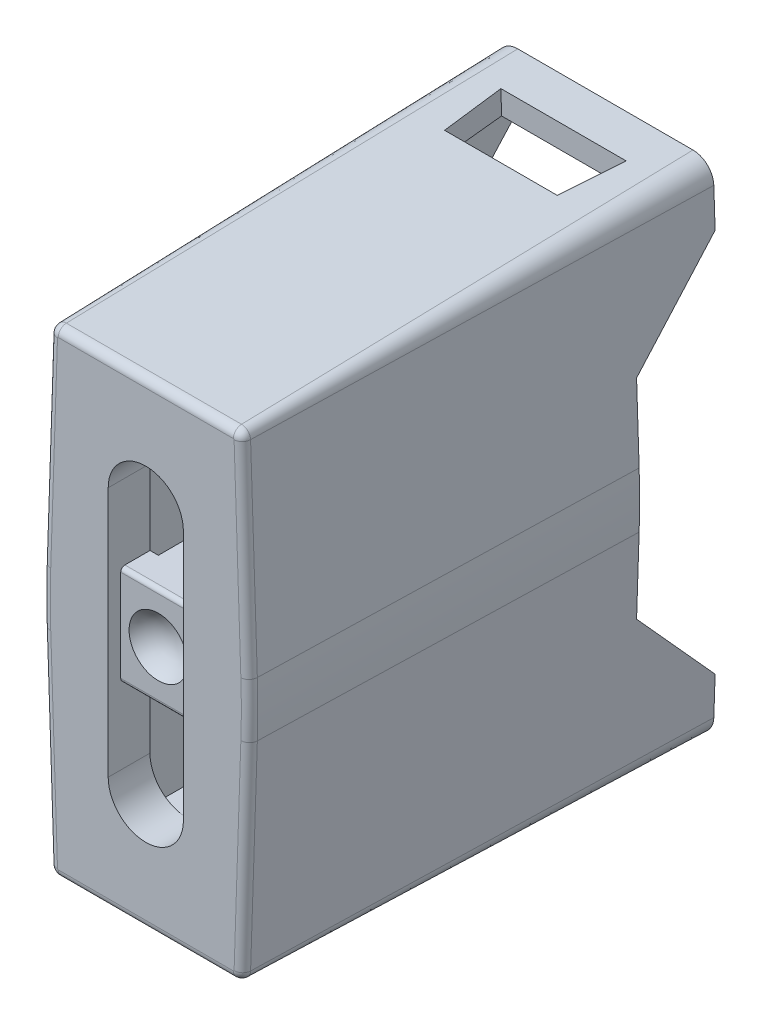
from build123d import *

# Parameters (mm, degrees)
BOSS_EXTRUDE1_DEPTH = 13.97
BOSS_EXTRUDE1_TAPER = 1.5
SKETCH2_W           = 5.461
SKETCH2_H           = 13.716
CUT_EXTRUDE1_DEPTH  = 8.255
CUT_EXTRUDE2_DEPTH  = 18.403644698
SKETCH5_W           = 5.334
SKETCH5_H           = 3.048
BOSS_EXTRUDE2_DEPTH = 2.286
SKETCH7_W           = 1.778
SKETCH7_H           = 3.048
CUT_EXTRUDE5_DEPTH  = 4.445
SKETCH9_W           = 1.778
SKETCH9_H           = 2.54
SKETCH9_H_2         = 1.397
CUT_EXTRUDE6_DEPTH  = 1.524
FILLET2_RADIUS      = 0.889
FILLET2_LENGTH      = 1.397
FILLET3_RADIUS      = 0.889
FILLET3_LENGTH      = 2.54
FILLET4_RADIUS      = 0.889
FILLET4_LENGTH      = 1.397
FILLET5_R           = 0.254
FILLET6_R           = 0.127
CUT_EXTRUDE7_REACH  = 23.72
CUT_EXTRUDE8_REACH  = 23.712
CUT_EXTRUDE10_DEPTH = 18.403644779


with BuildPart() as part:
    # Sketch1 → Boss-Extrude1 (new body)
    with BuildSketch(Plane.XY):
        with BuildLine():
            ThreePointArc((6.827680219, 7.006153229), (6.634503314, 7.441430334), (6.193032647, 7.62))
            Line((6.193032647, 7.62), (0.868167353, 7.62))
            ThreePointArc((0.868167353, 7.62), (0.426696686, 7.441430334), (0.233519781, 7.006153229))
            Line((0.233519781, 7.006153229), (0.028202051, 0.84612915))
            ThreePointArc((0.028202051, 0.84612915), (0.017629462, 0.423123288), (0.01410494, 0))
            ThreePointArc((0.01410494, 0), (0.017629462, -0.423123288), (0.028202051, -0.84612915))
            Line((0.028202051, -0.84612915), (0.233519781, -7.006153229))
            ThreePointArc((0.233519781, -7.006153229), (0.426696686, -7.441430334), (0.868167353, -7.62))
            Line((0.868167353, -7.62), (6.193032647, -7.62))
            ThreePointArc((6.193032647, -7.62), (6.634503314, -7.441430334), (6.827680219, -7.006153229))
            Line((6.827680219, -7.006153229), (7.032997949, -0.84612915))
            ThreePointArc((7.032997949, -0.84612915), (7.043570538, -0.423123288), (7.04709506, 0))
            ThreePointArc((7.04709506, 0), (7.043570538, 0.423123288), (7.032997949, 0.84612915))
            Line((7.032997949, 0.84612915), (6.827680219, 7.006153229))
        make_face()
    extrude(amount=BOSS_EXTRUDE1_DEPTH, taper=BOSS_EXTRUDE1_TAPER)

    # Sketch2 → Cut-Extrude1 (cut)
    with BuildSketch(Plane(origin=(0, 0, 0), x_dir=(-1, 0, 0), z_dir=(0, 0, -1))):
        with Locations((-3.52354753, 0)):
            Rectangle(SKETCH2_W, SKETCH2_H)
    extrude(amount=-CUT_EXTRUDE1_DEPTH, mode=Mode.SUBTRACT)

    # Sketch3 → Cut-Extrude2 (cut, through all)
    with BuildSketch(Plane.XY.offset(13.97)):
        with BuildLine():
            Line((4.6736, 3.81), (4.6736, -3.81))
            ThreePointArc((4.6736, -3.81), (3.5306, -4.953), (2.3876, -3.81))
            Line((2.3876, -3.81), (2.3876, 3.81))
            ThreePointArc((2.3876, 3.81), (3.5306, 4.953), (4.6736, 3.81))
        make_face()
    extrude(amount=-CUT_EXTRUDE2_DEPTH, mode=Mode.SUBTRACT)

    # Sketch5 → Boss-Extrude2 (add)
    with BuildSketch(Plane.ZY.offset(-4.6736)):
        with Locations((10.922, 0)):
            Rectangle(SKETCH5_W, SKETCH5_H)
    extrude(amount=BOSS_EXTRUDE2_DEPTH)

    # Sketch6 → Cut-Revolve1 (revolve, cut)
    with BuildSketch(Plane(origin=(0, 0, 0), x_dir=(1, 0, 0), z_dir=(0, 1, 0)), mode=Mode.PRIVATE) as cut_revolve1_sk:
        with BuildLine():
            Line((3.5306, -13.589), (3.5306, -13.081))
            ThreePointArc((3.5306, -13.081), (3.018646633, -13.216956608), (2.6416, -13.589))
            Line((2.6416, -13.589), (3.5306, -13.589))
        make_face()
    revolve(cut_revolve1_sk.sketch.rotate(Axis((3.5306, 0, 13.589), (0, 0, -1)), 180), axis=Axis((3.5306, 0, 13.589), (0, 0, -1)), mode=Mode.SUBTRACT)

    # Sketch7 → Cut-Extrude5 (cut)
    with BuildSketch(Plane(origin=(0, 0, 8.255), x_dir=(-1, 0, 0), z_dir=(0, 0, -1))):
        Polygon((-1.06115247, -6.604), (-2.6416, -6.604), (-2.6416, -4.953), (-4.4196, -4.953), (-4.4196, -6.604), (-6.00004753, -6.604), (-6.00004753, 6.604), (-4.4196, 6.604), (-4.4196, 4.953), (-2.6416, 4.953), (-2.6416, 6.604), (-1.06115247, 6.604), align=None)
        with Locations((-3.5306, 0)):
            Rectangle(SKETCH7_W, SKETCH7_H, mode=Mode.SUBTRACT)
    extrude(amount=-CUT_EXTRUDE5_DEPTH, mode=Mode.SUBTRACT)

    # Sketch9 → Cut-Extrude6 (cut)
    with BuildSketch(Plane(origin=(0, 0, 8.255), x_dir=(-1, 0, 0), z_dir=(0, 0, -1))):
        with Locations((-3.5306, 0)):
            Rectangle(SKETCH9_W, SKETCH9_H)
        with Locations((-3.5306, 5.9055)):
            Rectangle(SKETCH9_W, SKETCH9_H_2)
        with Locations((-3.5306, -5.9055)):
            Rectangle(SKETCH9_W, SKETCH9_H_2)
    extrude(amount=-CUT_EXTRUDE6_DEPTH, mode=Mode.SUBTRACT)

    # Fillet2: full round fillet: the end face becomes a half cylinder, R = half its width
    fillet2_face = Plane((3.5306, -5.9055, 9.779), x_dir=(0, -1, 0), z_dir=(0, 0, -1))  # on the end face: x along it, z out of the body
    fillet2_slab = fillet2_face.offset(-FILLET2_RADIUS / 2) * Box(FILLET2_LENGTH, 2 * FILLET2_RADIUS, FILLET2_RADIUS, mode=Mode.PRIVATE)  # the body's end, R deep
    fillet2_round = Plane((3.5306, -5.9055, 10.668), x_dir=(0, 0, -1), z_dir=(0, -1, 0)) * Cylinder(FILLET2_RADIUS, FILLET2_LENGTH, mode=Mode.PRIVATE)  # its axis R under the face
    add(fillet2_slab - fillet2_round, mode=Mode.SUBTRACT)

    # Fillet3: full round fillet: the end face becomes a half cylinder, R = half its width
    fillet3_face = Plane((3.5306, 0, 9.779), x_dir=(0, -1, 0), z_dir=(0, 0, -1))  # on the end face: x along it, z out of the body
    fillet3_slab = fillet3_face.offset(-FILLET3_RADIUS / 2) * Box(FILLET3_LENGTH, 2 * FILLET3_RADIUS, FILLET3_RADIUS, mode=Mode.PRIVATE)  # the body's end, R deep
    fillet3_round = Plane((3.5306, 0, 10.668), x_dir=(0, 0, -1), z_dir=(0, -1, 0)) * Cylinder(FILLET3_RADIUS, FILLET3_LENGTH, mode=Mode.PRIVATE)  # its axis R under the face
    add(fillet3_slab - fillet3_round, mode=Mode.SUBTRACT)

    # Fillet4: full round fillet: the end face becomes a half cylinder, R = half its width
    fillet4_face = Plane((3.5306, 5.9055, 9.779), x_dir=(0, -1, 0), z_dir=(0, 0, -1))  # on the end face: x along it, z out of the body
    fillet4_slab = fillet4_face.offset(-FILLET4_RADIUS / 2) * Box(FILLET4_LENGTH, 2 * FILLET4_RADIUS, FILLET4_RADIUS, mode=Mode.PRIVATE)  # the body's end, R deep
    fillet4_round = Plane((3.5306, 5.9055, 10.668), x_dir=(0, 0, -1), z_dir=(0, -1, 0)) * Cylinder(FILLET4_RADIUS, FILLET4_LENGTH, mode=Mode.PRIVATE)  # its axis R under the face
    add(fillet4_slab - fillet4_round, mode=Mode.SUBTRACT)

    # Fillet5
    fillet5_edges = [part.edges().sort_by_distance(p)[0] for p in [
        (0.681023644, 7.178485258, 13.97),
        (0.49647521, 3.91395502, 13.97),
        (0.383396026, 0.417029358, 13.97),
        (0.49647521, -3.91395502, 13.97),
        (0.681023644, -7.178485258, 13.97),
        (3.5306, -7.254182676, 13.97),
        (6.380176356, -7.178485258, 13.97),
        (6.56472479, -3.91395502, 13.97),
        (6.677803974, -0.417029358, 13.97),
        (6.380176356, 7.178485258, 13.97),
        (6.56472479, 3.91395502, 13.97),
        (3.5306, 7.254182676, 13.97),
    ]]
    fillet(fillet5_edges, radius=FILLET5_R)

    # Fillet6
    fillet6_edges = [part.edges().sort_by_distance(p)[0] for p in [
        (3.5306, -1.524, 13.589),
        (3.5306, 1.524, 13.589),
    ]]
    fillet(fillet6_edges, radius=FILLET6_R)

    # Cut-Extrude7: up to this plane
    cut_extrude7_end = Plane(origin=(6.25404753, -6.858, 28.733169612), z_dir=(0, -1, 0))
    # Sketch10 → Cut-Extrude7 (cut, up to the surface)
    with BuildSketch(Plane(origin=(0, -7.614778527, 0.199399993), x_dir=(-1, 0, 0), z_dir=(0, -0.9996573249755574, 0.026176948307873222)), mode=Mode.PRIVATE) as cut_extrude7_sk1:
        Polygon((-1.6256, -1.070531654), (-5.4356, -1.070531654), (-5.2451, -2.975531654), (-1.8161, -2.975531654), align=None)
    cut_extrude7_tool1 = split(extrude(cut_extrude7_sk1.sketch, amount=CUT_EXTRUDE7_REACH, dir=(0, 1, 0), mode=Mode.PRIVATE), bisect_by=cut_extrude7_end, keep=Keep.BOTH, mode=Mode.PRIVATE)
    add(cut_extrude7_tool1.solids().sort_by_distance((3.5306, -7.562259, 2.205034))[0], mode=Mode.SUBTRACT)

    # Cut-Extrude8: up to this plane
    cut_extrude8_end = Plane(origin=(6.25404753, 6.858, 28.733169612), z_dir=(0, 1, 0))
    # Sketch12 → Cut-Extrude8 (cut, up to the surface)
    with BuildSketch(Plane(origin=(0, 7.614778527, 0.199399993), x_dir=(1, 0, 0), z_dir=(0, 0.9996573249755574, 0.026176948307873222)), mode=Mode.PRIVATE) as cut_extrude8_sk1:
        Polygon((5.4356, -1.070531654), (1.6256, -1.070531654), (1.8161, -2.975531654), (5.2451, -2.975531654), align=None)
    cut_extrude8_tool1 = split(extrude(cut_extrude8_sk1.sketch, amount=-CUT_EXTRUDE8_REACH, mode=Mode.PRIVATE), bisect_by=cut_extrude8_end, keep=Keep.BOTH, mode=Mode.PRIVATE)
    add(cut_extrude8_tool1.solids().sort_by_distance((3.5306, 7.562259, 2.205034))[0], mode=Mode.SUBTRACT)

    # Sketch13 → Cut-Extrude10 (cut, through all)
    with BuildSketch(Plane(origin=(0, 0, 0), x_dir=(0, 0, -1), z_dir=(1, 0, 0))):
        Polygon((0, 5.842), (0, -5.842), (-2.413, -3.175), (-2.413, 3.175), align=None)
    extrude(amount=CUT_EXTRUDE10_DEPTH, mode=Mode.SUBTRACT)


solid = part.part
